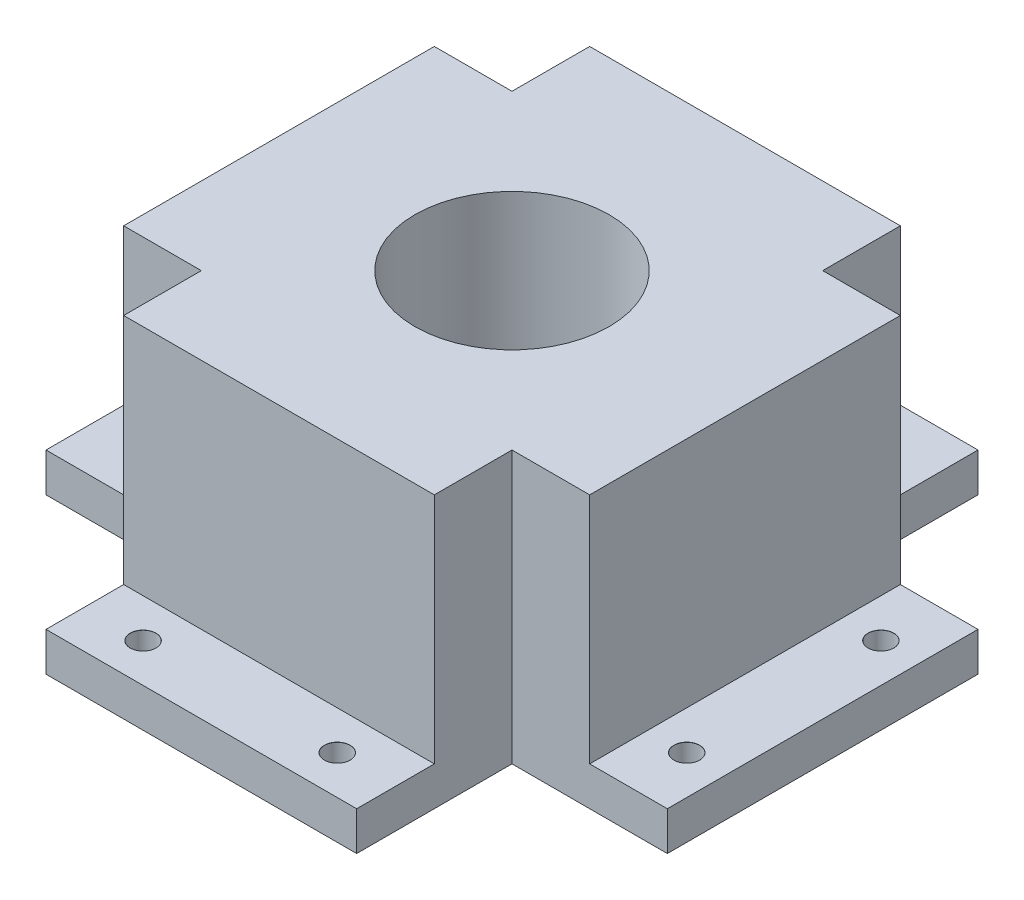
from build123d import *

# Parameters (mm, degrees)
SKETCH1_W                      = 160
SKETCH1_H                      = 160
BOSS_EXTRUDE1_DEPTH            = 70
SKETCH2_W                      = 40
SKETCH2_H                      = 40
CUT_EXTRUDE1_DEPTH             = 134.041346957
SKETCH3_W                      = 80
SKETCH3_H                      = 20
SKETCH3_W_2                    = 20
SKETCH3_H_2                    = 80
CUT_EXTRUDE2_DEPTH             = 60
CUT_EXTRUDE3_REACH             = 135.041
SKETCH4_R                      = 25
M6_CLEARANCE_HOLE1_D           = 6.6
M6_CLEARANCE_HOLE1_CSINK_D     = 6.65
M6_CLEARANCE_HOLE1_CSINK_ANGLE = 100


with BuildPart() as part:
    # Sketch1 → Boss-Extrude1 (new body)
    with BuildSketch(Plane(origin=(0, 0, 0), x_dir=(1, 0, 0), z_dir=(0, 1, 0))):
        Rectangle(SKETCH1_W, SKETCH1_H)
    extrude(amount=BOSS_EXTRUDE1_DEPTH)

    # Sketch2 → Cut-Extrude1 (cut, through all)
    with BuildSketch(Plane(origin=(0, 70, 0), x_dir=(1, 0, 0), z_dir=(0, 1, 0))):
        with Locations((-60, 60)):
            Rectangle(SKETCH2_W, SKETCH2_H)
        with Locations((60, 60)):
            Rectangle(SKETCH2_W, SKETCH2_H)
        with Locations((-60, -60)):
            Rectangle(SKETCH2_W, SKETCH2_H)
        with Locations((60, -60)):
            Rectangle(SKETCH2_W, SKETCH2_H)
    extrude(amount=-CUT_EXTRUDE1_DEPTH, mode=Mode.SUBTRACT)

    # Sketch3 → Cut-Extrude2 (cut)
    with BuildSketch(Plane(origin=(0, 70, 0), x_dir=(1, 0, 0), z_dir=(0, 1, 0))):
        with Locations((0, 70)):
            Rectangle(SKETCH3_W, SKETCH3_H)
        with Locations((-70, 0)):
            Rectangle(SKETCH3_W_2, SKETCH3_H_2)
        with Locations((70, 0)):
            Rectangle(SKETCH3_W_2, SKETCH3_H_2)
        with Locations((0, -70)):
            Rectangle(SKETCH3_W, SKETCH3_H)
    extrude(amount=-CUT_EXTRUDE2_DEPTH, mode=Mode.SUBTRACT)

    # Sketch4 → Cut-Extrude3 (cut, up to next)
    with BuildSketch(Plane(origin=(0, 70, 0), x_dir=(1, 0, 0), z_dir=(0, 1, 0)), mode=Mode.PRIVATE) as cut_extrude3_sk1:
        with Locations(Location((0, 0, 0), (0, 0, 270))):
            Circle(SKETCH4_R)
    cut_extrude3_tool1 = extrude(cut_extrude3_sk1.sketch, amount=-CUT_EXTRUDE3_REACH, mode=Mode.PRIVATE) & part.part
    add(cut_extrude3_tool1.solids().sort_by_distance((0, 70, 0))[0], mode=Mode.SUBTRACT)

    # M6 Clearance Hole1 (through all)
    with Locations(Plane(origin=(0, 10, 0), x_dir=(1, 0, 0), z_dir=(0, 1, 0))):
        with Locations((-70, 25), (-70, -25), (-25, 70), (25, 70), (70, 25), (70, -25), (25, -70), (-25, -70)):
            CounterSinkHole(M6_CLEARANCE_HOLE1_D / 2, M6_CLEARANCE_HOLE1_CSINK_D / 2, counter_sink_angle=M6_CLEARANCE_HOLE1_CSINK_ANGLE)


solid = part.part
